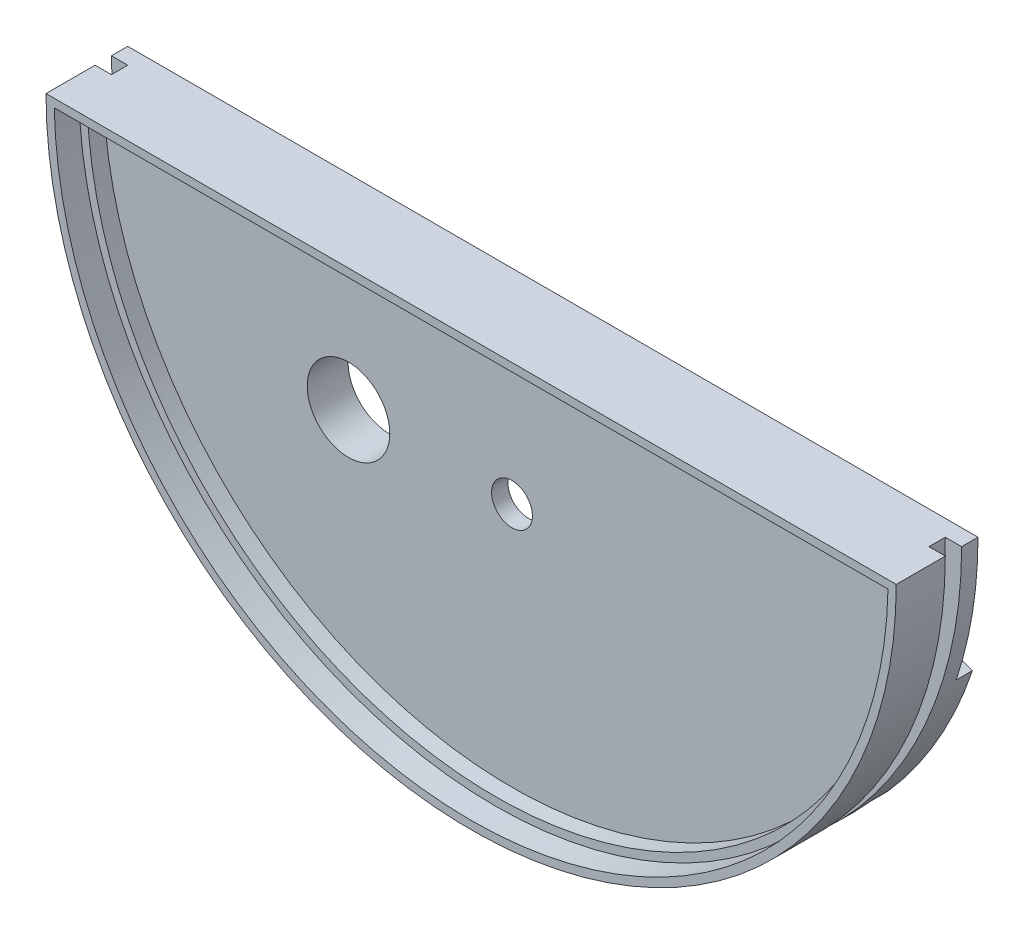
from build123d import *

# Parameters (mm, degrees)
SKETCH1_R           = 5.05
BOSS_EXTRUDE1_DEPTH = 5
BOSS_EXTRUDE2_START = 5
BOSS_EXTRUDE2_DEPTH = 5
BOSS_EXTRUDE4_DEPTH = 2
CUT_EXTRUDE1_START  = -3
SKETCH6_R           = 9.5
SKETCH6_R_2         = 5.05
CUT_EXTRUDE1_DEPTH  = 3
SKETCH7_R           = 2.5
CUT_EXTRUDE2_DEPTH  = 74.87151007
SKETCH8_R           = 4
BOSS_EXTRUDE5_DEPTH = 3
CUT_EXTRUDE3_DEPTH  = 3
SKETCH10_W          = 8.596273884
SKETCH10_H          = 2
CUT_REVOLVE1_ANGLE  = 180
SKETCH12_R          = 2


with BuildPart() as part:
    # Sketch1 → Boss-Extrude1 (new body)
    with BuildSketch(Plane.XY):
        with BuildLine():
            Line((-52, 0), (52, 0))
            ThreePointArc((52, 0), (0, -52), (-52, 0))
        make_face()
        with Locations((-20, -20)):
            Circle(SKETCH1_R, mode=Mode.SUBTRACT)
    extrude(amount=-BOSS_EXTRUDE1_DEPTH)

    # Sketch2 → Boss-Extrude2 (add)
    with BuildSketch(Plane.XY.offset(BOSS_EXTRUDE2_START)):
        with BuildLine():
            Line((52, 0), (-52, 0))
            ThreePointArc((-52, 0), (0, -52), (52, 0))
        make_face()
        with BuildLine():
            Line((49.959983987, -2), (-49.959983987, -2))
            ThreePointArc((-49.959983987, -2), (0, -50), (49.959983987, -2))
        make_face(mode=Mode.SUBTRACT)
    extrude(amount=-BOSS_EXTRUDE2_DEPTH)

    # Sketch5 → Boss-Extrude4 (add)
    with BuildSketch(Plane(origin=(0, 0, -5), x_dir=(-1, 0, 0), z_dir=(0, 0, -1))):
        with BuildLine():
            ThreePointArc((-49.323463146, -16.468029126), (-45.033320997, -26), (-38.923463146, -34.481357524))
            Line((-38.923463146, -34.481357524), (-37.426406871, -33.155151466))
            ThreePointArc((-37.426406871, -33.155151466), (-43.301270189, -25), (-47.426406871, -15.83464339))
            Line((-47.426406871, -15.83464339), (-49.323463146, -16.468029126))
        make_face()
        with BuildLine():
            Line((10.4, -50.94938665), (10, -48.989794856))
            ThreePointArc((10, -48.989794856), (0, -50), (-10, -48.989794856))
            Line((-10, -48.989794856), (-10.4, -50.94938665))
            ThreePointArc((-10.4, -50.94938665), (0, -52), (10.4, -50.94938665))
        make_face()
        with BuildLine():
            Line((37.426406871, -33.155151466), (38.923463146, -34.481357524))
            ThreePointArc((38.923463146, -34.481357524), (45.033320997, -26), (49.323463146, -16.468029126))
            Line((49.323463146, -16.468029126), (47.426406871, -15.83464339))
            ThreePointArc((47.426406871, -15.83464339), (43.301270189, -25), (37.426406871, -33.155151466))
        make_face()
    extrude(amount=BOSS_EXTRUDE4_DEPTH)

    # Sketch6 → Cut-Extrude1 (cut)
    with BuildSketch(Plane(origin=(0, 0, -5), x_dir=(-1, 0, 0), z_dir=(0, 0, -1)).offset(CUT_EXTRUDE1_START)):
        with Locations((0, -20)):
            Circle(SKETCH6_R)
        with Locations(Location((20, -20, 0), (0, 0, 180))):
            Circle(SKETCH6_R_2)
    extrude(amount=CUT_EXTRUDE1_DEPTH, mode=Mode.SUBTRACT)

    # Sketch7 → Cut-Extrude2 (cut, through all)
    with BuildSketch(Plane(origin=(0, 0, -2), x_dir=(-1, 0, 0), z_dir=(0, 0, -1))):
        with Locations((0, -20)):
            Circle(SKETCH7_R)
    extrude(amount=-CUT_EXTRUDE2_DEPTH, mode=Mode.SUBTRACT)

    # Sketch8 → Boss-Extrude5 (add)
    with BuildSketch(Plane(origin=(0, 0, -5), x_dir=(-1, 0, 0), z_dir=(0, 0, -1))):
        with Locations(Location((-20, -20, 0), (0, 0, 180))):
            Circle(SKETCH8_R)
    extrude(amount=BOSS_EXTRUDE5_DEPTH)

    # Sketch9 → Cut-Extrude3 (cut)
    # profile 1 of 2: a face of its own
    with BuildSketch(Plane.XY.offset(5)):
        with BuildLine():
            Line((50.990195136, -1), (-50.990195136, -1))
            ThreePointArc((-50.990195136, -1), (0, -51), (50.990195136, -1))
        make_face()
        with BuildLine():
            ThreePointArc((49.959983987, -2), (0, -50), (-49.959983987, -2))
            Line((-49.959983987, -2), (49.959983987, -2))
        make_face(mode=Mode.SUBTRACT)
    # profile 2 of 2: a face of its own
    with BuildSketch(Plane.XY.offset(5)):
        with BuildLine():
            Line((-49.959983987, -2), (49.959983987, -2))
            ThreePointArc((49.959983987, -2), (0, -50), (-49.959983987, -2))
        make_face()
    extrude(amount=-CUT_EXTRUDE3_DEPTH, mode=Mode.SUBTRACT)

    # Sketch10 → Cut-Revolve1 (revolve, cut)
    with BuildSketch(Plane(origin=(0, 0, 0), x_dir=(1, 0, 0), z_dir=(0, 1, 0))):
        with Locations((54.298136942, 2)):
            Rectangle(SKETCH10_W, SKETCH10_H)
    revolve(axis=Axis((0, 0, -7.000025), (0, 0, -1)), revolution_arc=CUT_REVOLVE1_ANGLE, mode=Mode.SUBTRACT)

    # Sketch12 → Cut-Revolve2 (revolve, cut)
    with BuildSketch(Plane(origin=(0, -20, 0), x_dir=(1, 0, 0), z_dir=(0, 1, 0)), mode=Mode.PRIVATE) as cut_revolve2_sk:
        with Locations((-12, 5)):
            Circle(SKETCH12_R)
    revolve(cut_revolve2_sk.sketch.rotate(Axis((-20, -20, -5), (0, 0, 1)), 180), axis=Axis((-20, -20, -5), (0, 0, 1)), mode=Mode.SUBTRACT)


solid = part.part
